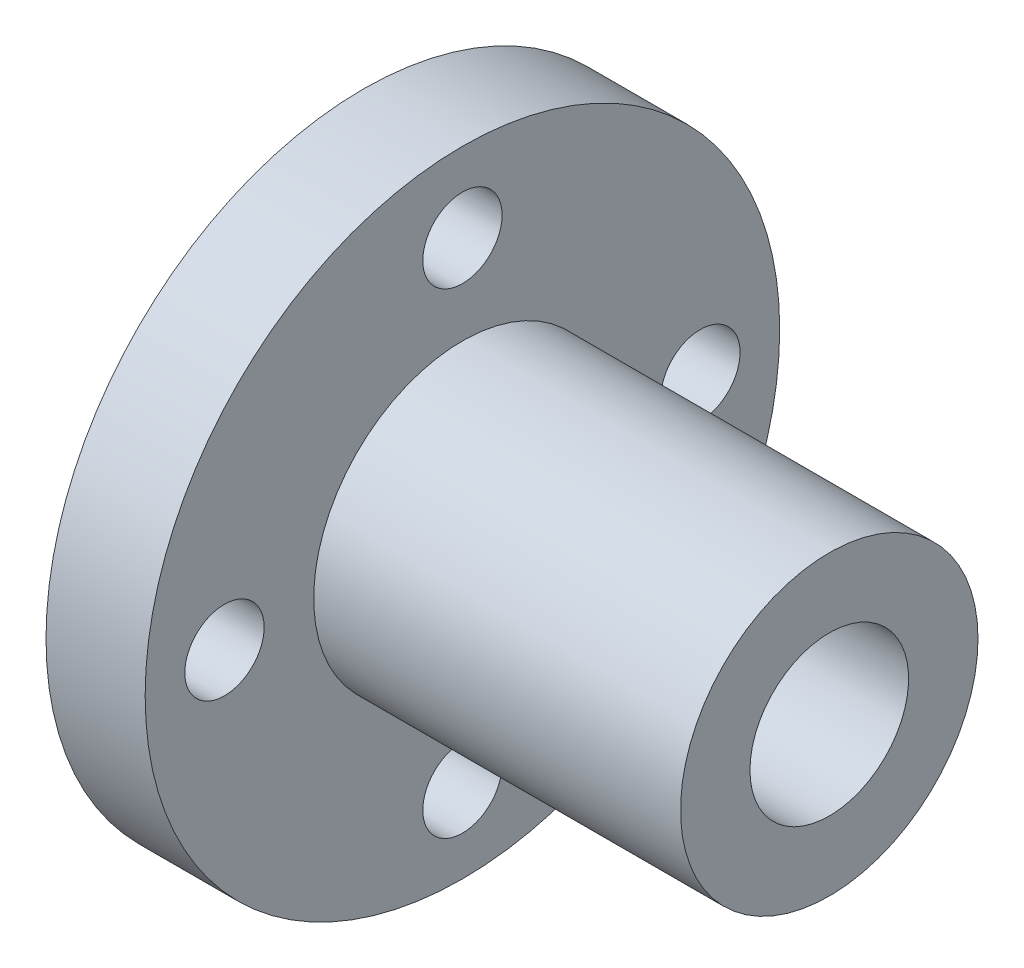
from build123d import *

# Parameters (mm, degrees)
SKETCH1_R               = 16
SKETCH1_R_2             = 2
BOSS_EXTRUDE1_DEPTH     = 5
SKETCH2_R               = 7.5
BOSS_EXTRUDE2_DEPTH     = 18.5
CUT_EXTRUDE1_DEPTH      = 33.622844756
CUT_EXTRUDE1_DEPTH_BACK = 33.622844756
SKETCH3_R               = 4


with BuildPart() as part:
    # Sketch1 → Boss-Extrude1 (new body)
    with BuildSketch(Plane(origin=(0, 0, 0), x_dir=(0, 0, -1), z_dir=(1, 0, 0))):
        Circle(SKETCH1_R)
        with Locations((0, 12)):
            Circle(SKETCH1_R_2, mode=Mode.SUBTRACT)
        with Locations((12, 0)):
            Circle(SKETCH1_R_2, mode=Mode.SUBTRACT)
        with Locations((0, -12)):
            Circle(SKETCH1_R_2, mode=Mode.SUBTRACT)
        with Locations((-12, 0)):
            Circle(SKETCH1_R_2, mode=Mode.SUBTRACT)
    extrude(amount=BOSS_EXTRUDE1_DEPTH)

    # Sketch2 → Boss-Extrude2 (add)
    with BuildSketch(Plane(origin=(5, 0, 0), x_dir=(0, 0, -1), z_dir=(1, 0, 0))):
        Circle(SKETCH2_R)
    extrude(amount=BOSS_EXTRUDE2_DEPTH)

    # Sketch3 → Cut-Extrude1 (cut, two sides: drawn at the far end of the back side and taken through both)
    with BuildSketch(Plane.ZY.offset(-CUT_EXTRUDE1_DEPTH_BACK)):
        Circle(SKETCH3_R)
    extrude(amount=CUT_EXTRUDE1_DEPTH + CUT_EXTRUDE1_DEPTH_BACK, mode=Mode.SUBTRACT)


solid = part.part
